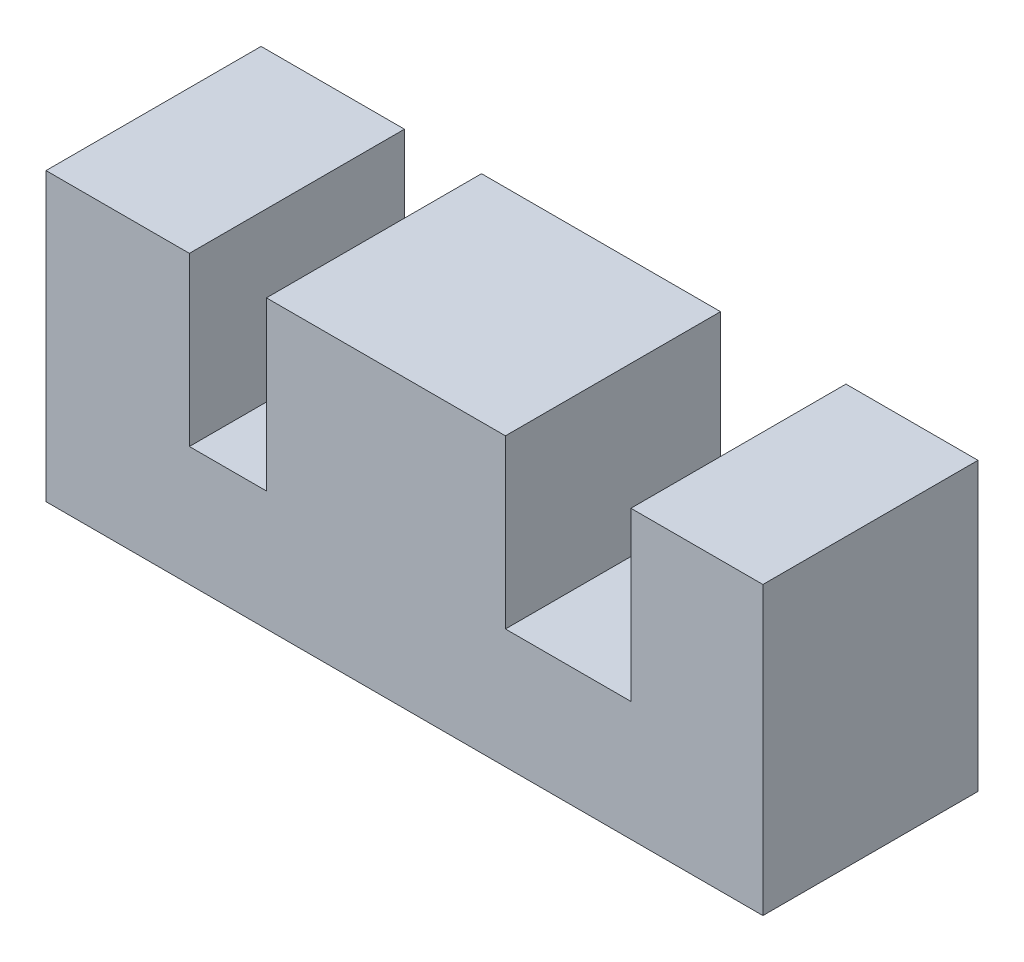
from build123d import *

# Parameters (mm, degrees)
SKETCH2_W           = 60
SKETCH2_H           = 18
BOSS_EXTRUDE1_DEPTH = 10
SKETCH3_W           = 12
SKETCH3_H           = 18
SKETCH3_W_2         = 20
SKETCH3_W_3         = 11.05
BOSS_EXTRUDE2_DEPTH = 14


with BuildPart() as part:
    # Sketch2 → Boss-Extrude1 (new body)
    with BuildSketch(Plane(origin=(0, 0, 0), x_dir=(1, 0, 0), z_dir=(0, 1, 0))):
        with Locations((-6.929824561, 0.780701754)):
            Rectangle(SKETCH2_W, SKETCH2_H)
    extrude(amount=BOSS_EXTRUDE1_DEPTH)

    # Sketch3 → Boss-Extrude2 (add)
    with BuildSketch(Plane(origin=(0, 10, 0), x_dir=(1, 0, 0), z_dir=(0, 1, 0))):
        with Locations((-30.929824561, 0.780701754)):
            Rectangle(SKETCH3_W, SKETCH3_H)
        with Locations((-8.479824561, 0.780701754)):
            Rectangle(SKETCH3_W_2, SKETCH3_H)
        with Locations((17.545175439, 0.780701754)):
            Rectangle(SKETCH3_W_3, SKETCH3_H)
    extrude(amount=BOSS_EXTRUDE2_DEPTH)


solid = part.part
